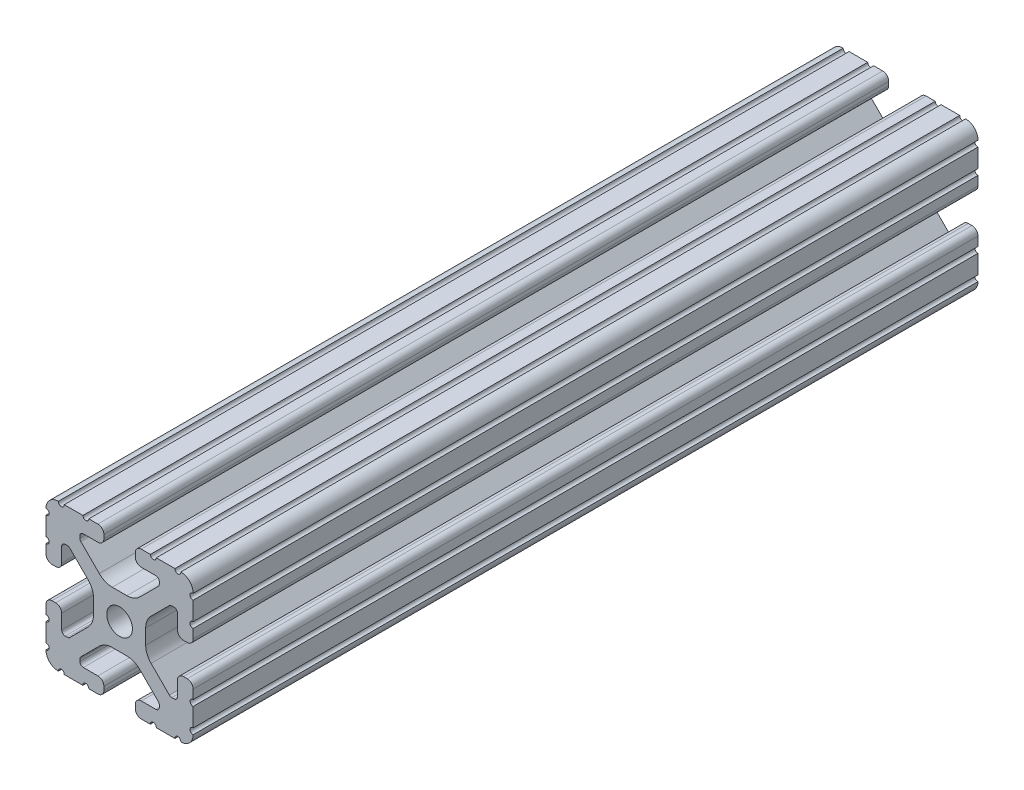
from build123d import *

# Parameters (mm, degrees)
SKETCH1_R      = 3.3274
EXTRUDE1_DEPTH = 203.2


with BuildPart() as part:
    # Sketch1 → Extrude1 (new body)
    with BuildSketch(Plane.XY):
        with BuildLine():
            Line((-10.022898969, 12.91475973), (-5.252158105, 8.144007132))
            ThreePointArc((-5.252158105, 8.144007132), (-3.715177372, 7.117027388), (-1.902183975, 6.7564))
            Line((-1.902183975, 6.7564), (1.902183975, 6.7564))
            ThreePointArc((1.902183975, 6.7564), (3.715177372, 7.117027388), (5.252158105, 8.144007132))
            Line((5.252158105, 8.144007132), (10.022898969, 12.91475973))
            ThreePointArc((10.022898969, 12.91475973), (10.218362387, 13.207291992), (10.287, 13.552357131))
            Line((10.287, 13.552357131), (10.287, 14.0843))
            ThreePointArc((10.287, 14.0843), (10.022898185, 14.721898185), (9.3853, 14.986))
            Line((9.3853, 14.986), (5.617617549, 14.986))
            ThreePointArc((5.617617549, 14.986), (4.519044045, 15.441044045), (4.064, 16.539617549))
            Line((4.064, 16.539617549), (4.064, 17.496382451))
            ThreePointArc((4.064, 17.496382451), (4.519044045, 18.594955955), (5.617617549, 19.05))
            Line((5.617617549, 19.05), (7.974178704, 19.05))
            ThreePointArc((7.974178704, 19.05), (8.736178704, 18.288), (9.498178704, 19.05))
            Line((9.498178704, 19.05), (14.327719207, 19.05))
            ThreePointArc((14.327719207, 19.05), (15.087603123, 18.231251131), (15.847487039, 19.05))
            ThreePointArc((15.847487039, 19.05), (18.120176289, 18.120192083), (19.05, 15.847509295))
            ThreePointArc((19.05, 15.847509295), (18.231250992, 15.08762539), (19.05, 14.327741484))
            Line((19.05, 14.327741484), (19.05, 9.496091471))
            ThreePointArc((19.05, 9.496091471), (18.231250992, 8.736207565), (19.05, 7.97632366))
            Line((19.05, 7.97632366), (19.05, 5.617617549))
            ThreePointArc((19.05, 5.617617549), (18.594955955, 4.519044045), (17.496382451, 4.064))
            Line((17.496382451, 4.064), (16.539617549, 4.064))
            ThreePointArc((16.539617549, 4.064), (15.441044045, 4.519044045), (14.986, 5.617617549))
            Line((14.986, 5.617617549), (14.986, 9.385342516))
            ThreePointArc((14.986, 9.385342516), (14.721898185, 10.022940701), (14.0843, 10.287042516))
            Line((14.0843, 10.287042516), (13.516042086, 10.287042516))
            ThreePointArc((13.516042086, 10.287042516), (13.170975923, 10.218404478), (12.878443117, 10.022939917))
            Line((12.878443117, 10.022939917), (8.14758008, 5.292065243))
            ThreePointArc((8.14758008, 5.292065243), (7.117955879, 3.751120653), (6.7564, 1.933453584))
            Line((6.7564, 1.933453584), (6.7564, -1.933453584))
            ThreePointArc((6.7564, -1.933453584), (7.117955879, -3.751120653), (8.14758008, -5.292065243))
            Line((8.14758008, -5.292065243), (12.878443117, -10.022939917))
            ThreePointArc((12.878443117, -10.022939917), (13.170975923, -10.218404478), (13.516042086, -10.287042516))
            Line((13.516042086, -10.287042516), (14.0843, -10.287042516))
            ThreePointArc((14.0843, -10.287042516), (14.721898185, -10.022940701), (14.986, -9.385342516))
            Line((14.986, -9.385342516), (14.986, -5.617617549))
            ThreePointArc((14.986, -5.617617549), (15.441044045, -4.519044045), (16.539617549, -4.064))
            Line((16.539617549, -4.064), (17.496382451, -4.064))
            ThreePointArc((17.496382451, -4.064), (18.594955955, -4.519044045), (19.05, -5.617617549))
            Line((19.05, -5.617617549), (19.05, -7.976318491))
            ThreePointArc((19.05, -7.976318491), (18.231250992, -8.736202396), (19.05, -9.496086302))
            Line((19.05, -9.496086302), (19.05, -14.32774291))
            ThreePointArc((19.05, -14.32774291), (18.231250992, -15.087626816), (19.05, -15.847510721))
            ThreePointArc((19.05, -15.847510721), (18.120175716, -18.120192644), (15.847486868, -19.05))
            ThreePointArc((15.847486868, -19.05), (15.087602952, -18.231251131), (14.327719036, -19.05))
            Line((14.327719036, -19.05), (9.496062448, -19.05))
            ThreePointArc((9.496062448, -19.05), (8.736178532, -18.231251131), (7.976294616, -19.05))
            Line((7.976294616, -19.05), (5.617617549, -19.05))
            ThreePointArc((5.617617549, -19.05), (4.519044045, -18.594955955), (4.064, -17.496382451))
            Line((4.064, -17.496382451), (4.064, -16.539617549))
            ThreePointArc((4.064, -16.539617549), (4.519044045, -15.441044045), (5.617617549, -14.986))
            Line((5.617617549, -14.986), (9.3853, -14.986))
            ThreePointArc((9.3853, -14.986), (10.022898185, -14.721898185), (10.287, -14.0843))
            Line((10.287, -14.0843), (10.287, -13.552357131))
            ThreePointArc((10.287, -13.552357131), (10.218362387, -13.207291992), (10.022898969, -12.91475973))
            Line((10.022898969, -12.91475973), (5.252158105, -8.144007132))
            ThreePointArc((5.252158105, -8.144007132), (3.715177372, -7.117027388), (1.902183975, -6.7564))
            Line((1.902183975, -6.7564), (-1.902183975, -6.7564))
            ThreePointArc((-1.902183975, -6.7564), (-3.715177372, -7.117027388), (-5.252158105, -8.144007132))
            Line((-5.252158105, -8.144007132), (-10.022898969, -12.91475973))
            ThreePointArc((-10.022898969, -12.91475973), (-10.218362387, -13.207291992), (-10.287, -13.552357131))
            Line((-10.287, -13.552357131), (-10.287, -14.0843))
            ThreePointArc((-10.287, -14.0843), (-10.022898185, -14.721898185), (-9.3853, -14.986))
            Line((-9.3853, -14.986), (-5.617617549, -14.986))
            ThreePointArc((-5.617617549, -14.986), (-4.519044045, -15.441044045), (-4.064, -16.539617549))
            Line((-4.064, -16.539617549), (-4.064, -17.496382451))
            ThreePointArc((-4.064, -17.496382451), (-4.519044045, -18.594955955), (-5.617617549, -19.05))
            Line((-5.617617549, -19.05), (-7.976294616, -19.05))
            ThreePointArc((-7.976294616, -19.05), (-8.736178532, -18.231251131), (-9.496062448, -19.05))
            Line((-9.496062448, -19.05), (-14.327719036, -19.05))
            ThreePointArc((-14.327719036, -19.05), (-15.087602952, -18.231251131), (-15.847486868, -19.05))
            ThreePointArc((-15.847486868, -19.05), (-18.120175716, -18.120192644), (-19.05, -15.847510721))
            ThreePointArc((-19.05, -15.847510721), (-18.231250992, -15.087626816), (-19.05, -14.32774291))
            Line((-19.05, -14.32774291), (-19.05, -9.496086302))
            ThreePointArc((-19.05, -9.496086302), (-18.231250992, -8.736202396), (-19.05, -7.976318491))
            Line((-19.05, -7.976318491), (-19.05, -5.617617549))
            ThreePointArc((-19.05, -5.617617549), (-18.594955955, -4.519044045), (-17.496382451, -4.064))
            Line((-17.496382451, -4.064), (-16.539617549, -4.064))
            ThreePointArc((-16.539617549, -4.064), (-15.441044045, -4.519044045), (-14.986, -5.617617549))
            Line((-14.986, -5.617617549), (-14.986, -9.385342516))
            ThreePointArc((-14.986, -9.385342516), (-14.721898185, -10.022940701), (-14.0843, -10.287042516))
            Line((-14.0843, -10.287042516), (-13.516042086, -10.287042516))
            ThreePointArc((-13.516042086, -10.287042516), (-13.170975923, -10.218404478), (-12.878443117, -10.022939917))
            Line((-12.878443117, -10.022939917), (-8.14758008, -5.292065243))
            ThreePointArc((-8.14758008, -5.292065243), (-7.117955879, -3.751120653), (-6.7564, -1.933453584))
            Line((-6.7564, -1.933453584), (-6.7564, 1.933453584))
            ThreePointArc((-6.7564, 1.933453584), (-7.117955879, 3.751120653), (-8.14758008, 5.292065243))
            Line((-8.14758008, 5.292065243), (-12.878443117, 10.022939917))
            ThreePointArc((-12.878443117, 10.022939917), (-13.170975923, 10.218404478), (-13.516042086, 10.287042516))
            Line((-13.516042086, 10.287042516), (-14.0843, 10.287042516))
            ThreePointArc((-14.0843, 10.287042516), (-14.721898185, 10.022940701), (-14.986, 9.385342516))
            Line((-14.986, 9.385342516), (-14.986, 5.617617549))
            ThreePointArc((-14.986, 5.617617549), (-15.441044045, 4.519044045), (-16.539617549, 4.064))
            Line((-16.539617549, 4.064), (-17.496382451, 4.064))
            ThreePointArc((-17.496382451, 4.064), (-18.594955955, 4.519044045), (-19.05, 5.617617549))
            Line((-19.05, 5.617617549), (-19.05, 7.97632366))
            ThreePointArc((-19.05, 7.97632366), (-18.231250992, 8.736207565), (-19.05, 9.496091471))
            Line((-19.05, 9.496091471), (-19.05, 14.327741484))
            ThreePointArc((-19.05, 14.327741484), (-18.231250992, 15.08762539), (-19.05, 15.847509295))
            ThreePointArc((-19.05, 15.847509295), (-18.120176289, 18.120192083), (-15.847487039, 19.05))
            ThreePointArc((-15.847487039, 19.05), (-15.087603123, 18.231251131), (-14.327719207, 19.05))
            Line((-14.327719207, 19.05), (-9.498178704, 19.05))
            ThreePointArc((-9.498178704, 19.05), (-8.736178704, 18.288), (-7.974178704, 19.05))
            Line((-7.974178704, 19.05), (-5.617617549, 19.05))
            ThreePointArc((-5.617617549, 19.05), (-4.519044045, 18.594955955), (-4.064, 17.496382451))
            Line((-4.064, 17.496382451), (-4.064, 16.539617549))
            ThreePointArc((-4.064, 16.539617549), (-4.519044045, 15.441044045), (-5.617617549, 14.986))
            Line((-5.617617549, 14.986), (-9.3853, 14.986))
            ThreePointArc((-9.3853, 14.986), (-10.022898185, 14.721898185), (-10.287, 14.0843))
            Line((-10.287, 14.0843), (-10.287, 13.552357131))
            ThreePointArc((-10.287, 13.552357131), (-10.218362387, 13.207291992), (-10.022898969, 12.91475973))
        make_face()
        Circle(SKETCH1_R, mode=Mode.SUBTRACT)
    extrude(amount=-EXTRUDE1_DEPTH)


solid = part.part
